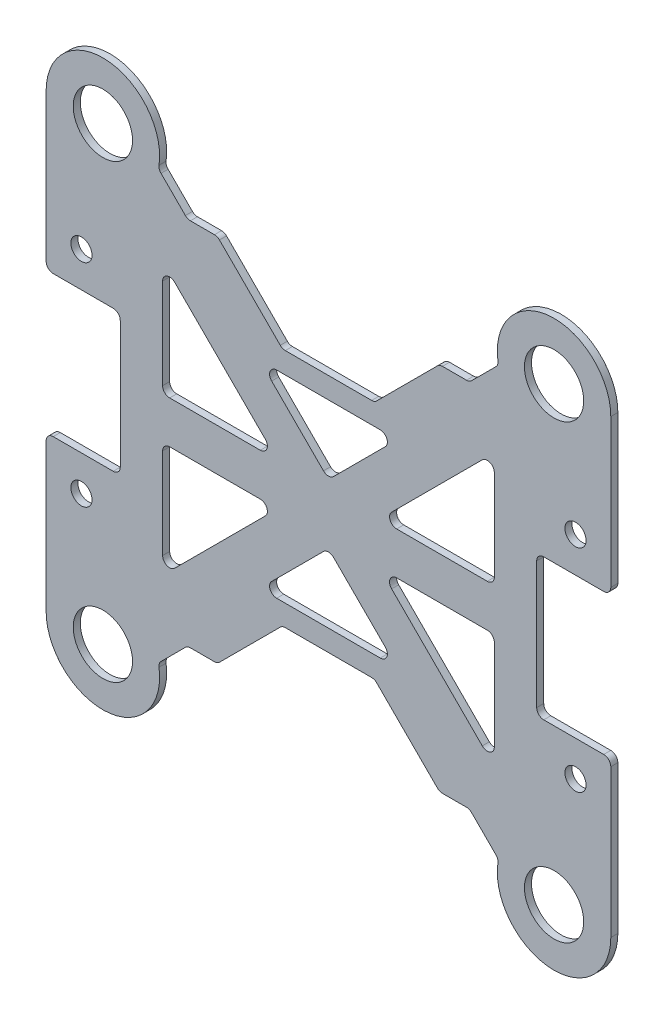
from build123d import *

# Parameters (mm, degrees)
MODEL_R         = 4.2
MODEL_R_2       = 1.5
EXTRUDE_1_DEPTH = 1


with BuildPart() as part:
    # Model → Бобышка-Вытянуть1 (new body)
    with BuildSketch(Plane.XY):
        with BuildLine():
            ThreePointArc((-40, 11), (-39.707106781, 10.292893219), (-39, 10))
            Line((-39, 10), (-30.5, 10))
            ThreePointArc((-30.5, 10), (-29.792893219, 9.707106781), (-29.5, 9))
            Line((-29.5, 9), (-29.5, 0))
            Line((-29.5, 0), (-29.5, -9))
            ThreePointArc((-29.5, -9), (-29.792893219, -9.707106781), (-30.5, -10))
            Line((-30.5, -10), (-39, -10))
            ThreePointArc((-39, -10), (-39.707106781, -10.292893219), (-40, -11))
            Line((-40, -11), (-40, -15))
            Line((-40, -15), (-40, -19))
            Line((-40, -19), (-40, -31.96122651))
            ThreePointArc((-40, -31.96122651), (-31.378483084, -39.978850181), (-24.006941008, -30.798806025))
            ThreePointArc((-24.006941008, -30.798806025), (-23.966641223, -30.339501194), (-23.724557848, -29.947097523))
            Line((-23.724557848, -29.947097523), (-20.270353544, -26.492893219))
            ThreePointArc((-20.270353544, -26.492893219), (-19.945930196, -26.276120467), (-19.563246763, -26.2))
            Line((-19.563246763, -26.2), (-16.149033201, -26.2))
            ThreePointArc((-16.149033201, -26.2), (-15.766349768, -26.123879533), (-15.44192642, -25.907106781))
            Line((-15.44192642, -25.907106781), (-6.827712857, -17.292893219))
            ThreePointArc((-6.827712857, -17.292893219), (-6.503289508, -17.076120467), (-6.120606076, -17))
            Line((-6.120606076, -17), (0, -17))
            Line((0, -17), (6.120606076, -17))
            ThreePointArc((6.120606076, -17), (6.503289508, -17.076120467), (6.827712857, -17.292893219))
            Line((6.827712857, -17.292893219), (15.44192642, -25.907106781))
            ThreePointArc((15.44192642, -25.907106781), (15.766349768, -26.123879533), (16.149033201, -26.2))
            Line((16.149033201, -26.2), (19.563246763, -26.2))
            ThreePointArc((19.563246763, -26.2), (19.945930196, -26.276120467), (20.270353544, -26.492893219))
            Line((20.270353544, -26.492893219), (23.724557848, -29.947097523))
            ThreePointArc((23.724557848, -29.947097523), (23.966641223, -30.339501194), (24.006941008, -30.798806025))
            ThreePointArc((24.006941008, -30.798806025), (31.378483084, -39.978850181), (40, -31.96122651))
            Line((40, -31.96122651), (40, -19))
            Line((40, -19), (40, -15))
            Line((40, -15), (40, -11))
            ThreePointArc((40, -11), (39.707106781, -10.292893219), (39, -10))
            Line((39, -10), (30.5, -10))
            ThreePointArc((30.5, -10), (29.792893219, -9.707106781), (29.5, -9))
            Line((29.5, -9), (29.5, 0))
            Line((29.5, 0), (29.5, 9))
            ThreePointArc((29.5, 9), (29.792893219, 9.707106781), (30.5, 10))
            Line((30.5, 10), (39, 10))
            ThreePointArc((39, 10), (39.707106781, 10.292893219), (40, 11))
            Line((40, 11), (40, 15))
            Line((40, 15), (40, 19))
            Line((40, 19), (40, 31.96122651))
            ThreePointArc((40, 31.96122651), (31.378483084, 39.978850181), (24.006941008, 30.798806025))
            ThreePointArc((24.006941008, 30.798806025), (23.966641223, 30.339501194), (23.724557848, 29.947097523))
            Line((23.724557848, 29.947097523), (20.270353544, 26.492893219))
            ThreePointArc((20.270353544, 26.492893219), (19.945930196, 26.276120467), (19.563246763, 26.2))
            Line((19.563246763, 26.2), (16.149033201, 26.2))
            ThreePointArc((16.149033201, 26.2), (15.766349768, 26.123879533), (15.44192642, 25.907106781))
            Line((15.44192642, 25.907106781), (6.827712857, 17.292893219))
            ThreePointArc((6.827712857, 17.292893219), (6.503289508, 17.076120467), (6.120606076, 17))
            Line((6.120606076, 17), (0, 17))
            Line((0, 17), (-6.120606076, 17))
            ThreePointArc((-6.120606076, 17), (-6.503289508, 17.076120467), (-6.827712857, 17.292893219))
            Line((-6.827712857, 17.292893219), (-15.44192642, 25.907106781))
            ThreePointArc((-15.44192642, 25.907106781), (-15.766349768, 26.123879533), (-16.149033201, 26.2))
            Line((-16.149033201, 26.2), (-19.563246763, 26.2))
            ThreePointArc((-19.563246763, 26.2), (-19.945930196, 26.276120467), (-20.270353544, 26.492893219))
            Line((-20.270353544, 26.492893219), (-23.724557848, 29.947097523))
            ThreePointArc((-23.724557848, 29.947097523), (-23.966641223, 30.339501194), (-24.006941008, 30.798806025))
            ThreePointArc((-24.006941008, 30.798806025), (-31.378483084, 39.978850181), (-40, 31.96122651))
            Line((-40, 31.96122651), (-40, 19))
            Line((-40, 19), (-40, 15))
            Line((-40, 15), (-40, 11))
        make_face()
        with Locations((-31.96122651, -31.96122651)):
            Circle(MODEL_R, mode=Mode.SUBTRACT)
        with Locations((-35, -15)):
            Circle(MODEL_R_2, mode=Mode.SUBTRACT)
        with BuildLine():
            ThreePointArc((-23.5, -4), (-23.207106781, -3.292893219), (-22.5, -3))
            Line((-22.5, -3), (-9.656854249, -3))
            ThreePointArc((-9.656854249, -3), (-8.732974717, -3.617316568), (-8.949747468, -4.707106781))
            Line((-8.949747468, -4.707106781), (-21.792893219, -17.550252532))
            ThreePointArc((-21.792893219, -17.550252532), (-22.882683432, -17.767025283), (-23.5, -16.843145751))
            Line((-23.5, -16.843145751), (-23.5, -6.777502295))
            Line((-23.5, -6.777502295), (-23.5, -4))
        make_face(mode=Mode.SUBTRACT)
        with Locations((31.96122651, -31.96122651)):
            Circle(MODEL_R, mode=Mode.SUBTRACT)
        with BuildLine():
            Line((9.656854249, -3), (22.5, -3))
            ThreePointArc((22.5, -3), (23.207106781, -3.292893219), (23.5, -4))
            Line((23.5, -4), (23.5, -6.777502295))
            Line((23.5, -6.777502295), (23.5, -16.843145751))
            ThreePointArc((23.5, -16.843145751), (22.882683432, -17.767025283), (21.792893219, -17.550252532))
            Line((21.792893219, -17.550252532), (8.949747468, -4.707106781))
            ThreePointArc((8.949747468, -4.707106781), (8.732974717, -3.617316568), (9.656854249, -3))
        make_face(mode=Mode.SUBTRACT)
        with BuildLine():
            Line((7.343145751, -14), (0, -14))
            Line((0, -14), (-7.343145751, -14))
            ThreePointArc((-7.343145751, -14), (-8.267025283, -13.382683432), (-8.050252532, -12.292893219))
            Line((-8.050252532, -12.292893219), (-0.707106781, -4.949747468))
            ThreePointArc((-0.707106781, -4.949747468), (-0.382683432, -4.732974717), (0, -4.656854249))
            ThreePointArc((0, -4.656854249), (0.382683432, -4.732974717), (0.707106781, -4.949747468))
            Line((0.707106781, -4.949747468), (8.050252532, -12.292893219))
            ThreePointArc((8.050252532, -12.292893219), (8.267025283, -13.382683432), (7.343145751, -14))
        make_face(mode=Mode.SUBTRACT)
        with Locations((35, -15)):
            Circle(MODEL_R_2, mode=Mode.SUBTRACT)
        with Locations((-35, 15)):
            Circle(MODEL_R_2, mode=Mode.SUBTRACT)
        with BuildLine():
            Line((-7.343145751, 14), (0, 14))
            Line((0, 14), (7.343145751, 14))
            ThreePointArc((7.343145751, 14), (8.267025283, 13.382683432), (8.050252532, 12.292893219))
            Line((8.050252532, 12.292893219), (0.707106781, 4.949747468))
            ThreePointArc((0.707106781, 4.949747468), (0.382683432, 4.732974717), (0, 4.656854249))
            ThreePointArc((0, 4.656854249), (-0.382683432, 4.732974717), (-0.707106781, 4.949747468))
            Line((-0.707106781, 4.949747468), (-8.050252532, 12.292893219))
            ThreePointArc((-8.050252532, 12.292893219), (-8.267025283, 13.382683432), (-7.343145751, 14))
        make_face(mode=Mode.SUBTRACT)
        with BuildLine():
            Line((-9.656854249, 3), (-22.5, 3))
            ThreePointArc((-22.5, 3), (-23.207106781, 3.292893219), (-23.5, 4))
            Line((-23.5, 4), (-23.5, 6.777502295))
            Line((-23.5, 6.777502295), (-23.5, 16.843145751))
            ThreePointArc((-23.5, 16.843145751), (-22.882683432, 17.767025283), (-21.792893219, 17.550252532))
            Line((-21.792893219, 17.550252532), (-8.949747468, 4.707106781))
            ThreePointArc((-8.949747468, 4.707106781), (-8.732974717, 3.617316568), (-9.656854249, 3))
        make_face(mode=Mode.SUBTRACT)
        with Locations((-31.96122651, 31.96122651)):
            Circle(MODEL_R, mode=Mode.SUBTRACT)
        with BuildLine():
            ThreePointArc((23.5, 4), (23.207106781, 3.292893219), (22.5, 3))
            Line((22.5, 3), (9.656854249, 3))
            ThreePointArc((9.656854249, 3), (8.732974717, 3.617316568), (8.949747468, 4.707106781))
            Line((8.949747468, 4.707106781), (21.792893219, 17.550252532))
            ThreePointArc((21.792893219, 17.550252532), (22.882683432, 17.767025283), (23.5, 16.843145751))
            Line((23.5, 16.843145751), (23.5, 6.777502295))
            Line((23.5, 6.777502295), (23.5, 4))
        make_face(mode=Mode.SUBTRACT)
        with Locations((35, 15)):
            Circle(MODEL_R_2, mode=Mode.SUBTRACT)
        with Locations((31.96122651, 31.96122651)):
            Circle(MODEL_R, mode=Mode.SUBTRACT)
    extrude(amount=EXTRUDE_1_DEPTH)


solid = part.part
